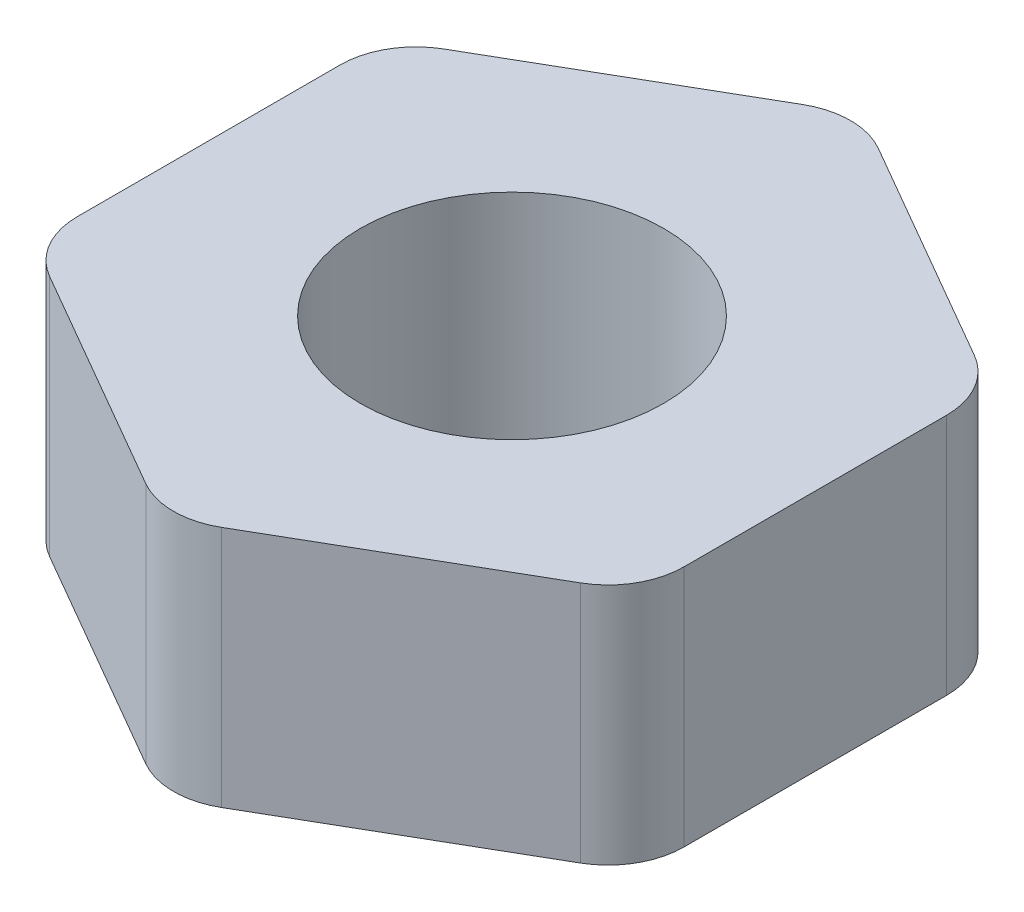
from build123d import *

# Parameters (mm, degrees)
SKETCH_1_R      = 1
EXTRUDE_1_DEPTH = 1.6
FILLET_1_R      = 0.5


with BuildPart() as part:
    # 草图1 → 凸台-拉伸1 (new body)
    with BuildSketch(Plane(origin=(0, 0, 0), x_dir=(1, 0, 0), z_dir=(0, 1, 0))):
        Polygon((0, 2.309401077), (-2, 1.154700538), (-2, -1.154700538), (0, -2.309401077), (2, -1.154700538), (2, 1.154700538), align=None)
        with Locations(Location((0, 0, 0), (0, 0, 270))):
            Circle(SKETCH_1_R, mode=Mode.SUBTRACT)
    extrude(amount=EXTRUDE_1_DEPTH)

    # 圆角1
    fillet_1_edges = [part.edges().sort_by_distance(p)[0] for p in [
        (2, 0.8, -1.154700538),
        (2, 0.8, 1.154700538),
        (0, 0.8, 2.309401077),
        (-2, 0.8, 1.154700538),
        (-2, 0.8, -1.154700538),
        (0, 0.8, -2.309401077),
    ]]
    fillet(fillet_1_edges, radius=FILLET_1_R)


solid = part.part
